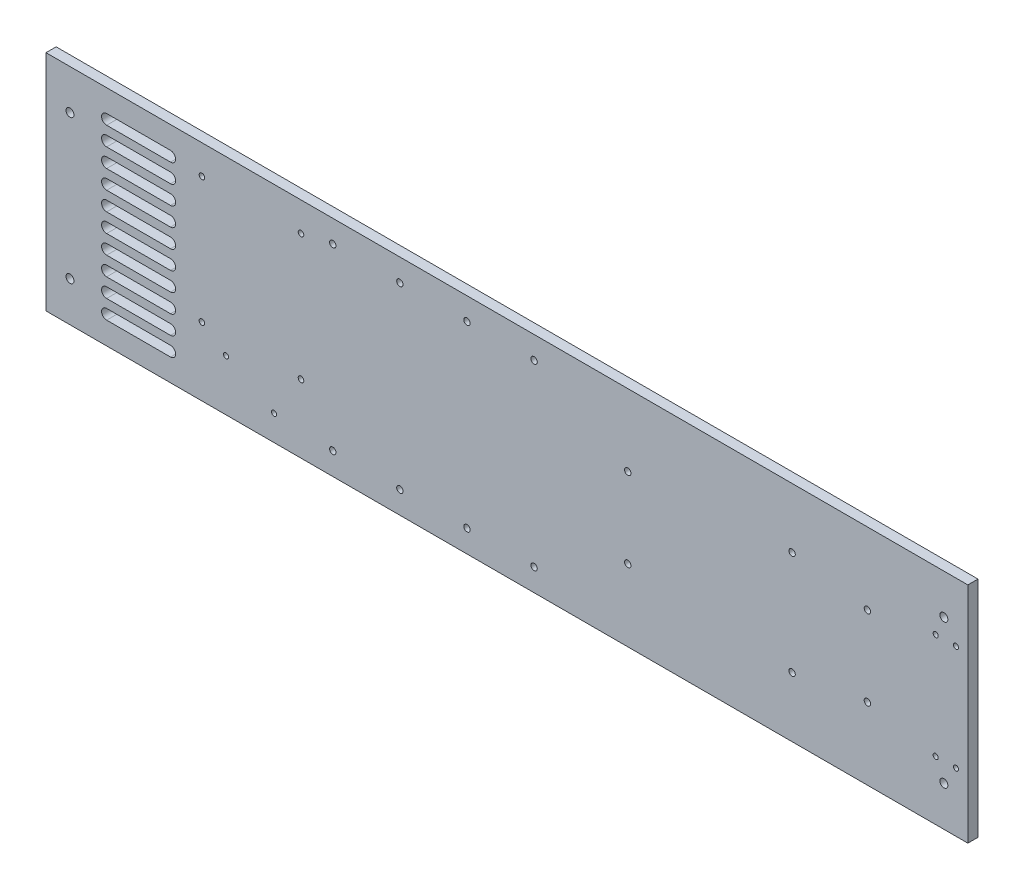
from build123d import *

# Parameters (mm, degrees)
SKETCH1_W           = 577
SKETCH1_H           = 140
BOSS_EXTRUDE1_DEPTH = 6.35
SKETCH2_R           = 2
SKETCH2_R_2         = 1.75
SKETCH2_R_3         = 1.6
SKETCH2_R_4         = 1.5875
CUT_EXTRUDE1_DEPTH  = 297.93866791
SKETCH4_R           = 2.5
CUT_EXTRUDE2_DEPTH  = 297.93866791
CUT_EXTRUDE3_DEPTH  = 297.93866791


with BuildPart() as part:
    # Sketch1 → Boss-Extrude1 (new body)
    with BuildSketch(Plane.XY):
        Rectangle(SKETCH1_W, SKETCH1_H)
    extrude(amount=BOSS_EXTRUDE1_DEPTH)

    # Sketch2 → Cut-Extrude1 (cut, through all)
    with BuildSketch(Plane.XY.offset(6.35)):
        with Locations((75.619965266, 25)):
            Circle(SKETCH2_R)
        with Locations(Location((225.619965266, 25, 0), (0, 0, 180))):
            Circle(SKETCH2_R)
        with Locations((225.619965266, -25)):
            Circle(SKETCH2_R)
        with Locations(Location((75.619965266, -25, 0), (0, 0, 180))):
            Circle(SKETCH2_R)
        with Locations((16.996201668, 56)):
            Circle(SKETCH2_R)
        with Locations(Location((16.996201668, -56, 0), (0, 0, 180))):
            Circle(SKETCH2_R)
        with Locations((-25.003798332, 56)):
            Circle(SKETCH2_R)
        with Locations(Location((-25.003798332, -56, 0), (0, 0, 180))):
            Circle(SKETCH2_R)
        with Locations((-67.003798332, 56)):
            Circle(SKETCH2_R)
        with Locations(Location((-67.003798332, -56, 0), (0, 0, 180))):
            Circle(SKETCH2_R)
        with Locations((-109.003798332, 56)):
            Circle(SKETCH2_R)
        with Locations(Location((-109.003798332, -56, 0), (0, 0, 180))):
            Circle(SKETCH2_R)
        with Locations((-128.889819491, 51.768262599)):
            Circle(SKETCH2_R_2)
        with Locations(Location((-190.889819491, 51.768262599, 0), (0, 0, 180))):
            Circle(SKETCH2_R_2)
        with Locations(Location((-128.889819491, -27.231737401, 0), (0, 0, 180))):
            Circle(SKETCH2_R_2)
        with Locations((-190.889819491, -27.231737401)):
            Circle(SKETCH2_R_2)
        with Locations((268.371258164, 33)):
            Circle(SKETCH2_R_3)
        with Locations(Location((281.071258164, 33, 0), (0, 0, 180))):
            Circle(SKETCH2_R_3)
        with Locations((281.071258164, -33)):
            Circle(SKETCH2_R_3)
        with Locations(Location((268.371258164, -33, 0), (0, 0, 180))):
            Circle(SKETCH2_R_3)
        with Locations((-145.778767067, -54.079001217)):
            Circle(SKETCH2_R_4)
        with Locations((-175.828767067, -37.929001217)):
            Circle(SKETCH2_R_4)
        with Locations((178.481684403, 32.5)):
            Circle(SKETCH2_R)
        with Locations(Location((178.481684403, -32.5, 0), (0, 0, 180))):
            Circle(SKETCH2_R)
    extrude(amount=-CUT_EXTRUDE1_DEPTH, mode=Mode.SUBTRACT)

    # Sketch4 → Cut-Extrude2 (cut, through all)
    with BuildSketch(Plane.XY.offset(6.35)):
        with Locations((-273.5, 45)):
            Circle(SKETCH4_R)
        with Locations(Location((273.5, 45, 0), (0, 0, 180))):
            Circle(SKETCH4_R)
        with Locations((273.5, -45)):
            Circle(SKETCH4_R)
        with Locations(Location((-273.5, -45, 0), (0, 0, 180))):
            Circle(SKETCH4_R)
    extrude(amount=-CUT_EXTRUDE2_DEPTH, mode=Mode.SUBTRACT)

    # Sketch5 → Cut-Extrude3 (cut, through all)
    with BuildSketch(Plane.XY.offset(6.35)):
        with BuildLine():
            Line((-250.546207845, 56), (-210.546207845, 56))
            ThreePointArc((-210.546207845, 56), (-207.371207845, 52.825), (-210.546207845, 49.65))
            Line((-210.546207845, 49.65), (-250.546207845, 49.65))
            ThreePointArc((-250.546207845, 49.65), (-253.721207845, 52.825), (-250.546207845, 56))
        make_face()
        with BuildLine():
            Line((-250.546207845, 44.261111111), (-210.546207845, 44.261111111))
            ThreePointArc((-210.546207845, 44.261111111), (-207.371207845, 41.086111111), (-210.546207845, 37.911111111))
            Line((-210.546207845, 37.911111111), (-250.546207845, 37.911111111))
            ThreePointArc((-250.546207845, 37.911111111), (-253.721207845, 41.086111111), (-250.546207845, 44.261111111))
        make_face()
        with BuildLine():
            Line((-250.546207845, 32.522222222), (-210.546207845, 32.522222222))
            ThreePointArc((-210.546207845, 32.522222222), (-207.371207845, 29.347222222), (-210.546207845, 26.172222222))
            Line((-210.546207845, 26.172222222), (-250.546207845, 26.172222222))
            ThreePointArc((-250.546207845, 26.172222222), (-253.721207845, 29.347222222), (-250.546207845, 32.522222222))
        make_face()
        with BuildLine():
            Line((-250.546207845, 20.783333333), (-210.546207845, 20.783333333))
            ThreePointArc((-210.546207845, 20.783333333), (-207.371207845, 17.608333333), (-210.546207845, 14.433333333))
            Line((-210.546207845, 14.433333333), (-250.546207845, 14.433333333))
            ThreePointArc((-250.546207845, 14.433333333), (-253.721207845, 17.608333333), (-250.546207845, 20.783333333))
        make_face()
        with BuildLine():
            Line((-250.546207845, 9.044444444), (-210.546207845, 9.044444444))
            ThreePointArc((-210.546207845, 9.044444444), (-207.371207845, 5.869444444), (-210.546207845, 2.694444444))
            Line((-210.546207845, 2.694444444), (-250.546207845, 2.694444444))
            ThreePointArc((-250.546207845, 2.694444444), (-253.721207845, 5.869444444), (-250.546207845, 9.044444444))
        make_face()
        with BuildLine():
            Line((-250.546207845, -2.694444444), (-210.546207845, -2.694444444))
            ThreePointArc((-210.546207845, -2.694444444), (-207.371207845, -5.869444444), (-210.546207845, -9.044444444))
            Line((-210.546207845, -9.044444444), (-250.546207845, -9.044444444))
            ThreePointArc((-250.546207845, -9.044444444), (-253.721207845, -5.869444444), (-250.546207845, -2.694444444))
        make_face()
        with BuildLine():
            Line((-250.546207845, -14.433333333), (-210.546207845, -14.433333333))
            ThreePointArc((-210.546207845, -14.433333333), (-207.371207845, -17.608333333), (-210.546207845, -20.783333333))
            Line((-210.546207845, -20.783333333), (-250.546207845, -20.783333333))
            ThreePointArc((-250.546207845, -20.783333333), (-253.721207845, -17.608333333), (-250.546207845, -14.433333333))
        make_face()
        with BuildLine():
            Line((-250.546207845, -26.172222222), (-210.546207845, -26.172222222))
            ThreePointArc((-210.546207845, -26.172222222), (-207.371207845, -29.347222222), (-210.546207845, -32.522222222))
            Line((-210.546207845, -32.522222222), (-250.546207845, -32.522222222))
            ThreePointArc((-250.546207845, -32.522222222), (-253.721207845, -29.347222222), (-250.546207845, -26.172222222))
        make_face()
        with BuildLine():
            Line((-250.546207845, -37.911111111), (-210.546207845, -37.911111111))
            ThreePointArc((-210.546207845, -37.911111111), (-207.371207845, -41.086111111), (-210.546207845, -44.261111111))
            Line((-210.546207845, -44.261111111), (-250.546207845, -44.261111111))
            ThreePointArc((-250.546207845, -44.261111111), (-253.721207845, -41.086111111), (-250.546207845, -37.911111111))
        make_face()
        with BuildLine():
            Line((-250.546207845, -49.65), (-210.546207845, -49.65))
            ThreePointArc((-210.546207845, -49.65), (-207.371207845, -52.825), (-210.546207845, -56))
            Line((-210.546207845, -56), (-250.546207845, -56))
            ThreePointArc((-250.546207845, -56), (-253.721207845, -52.825), (-250.546207845, -49.65))
        make_face()
    extrude(amount=-CUT_EXTRUDE3_DEPTH, mode=Mode.SUBTRACT)


solid = part.part
